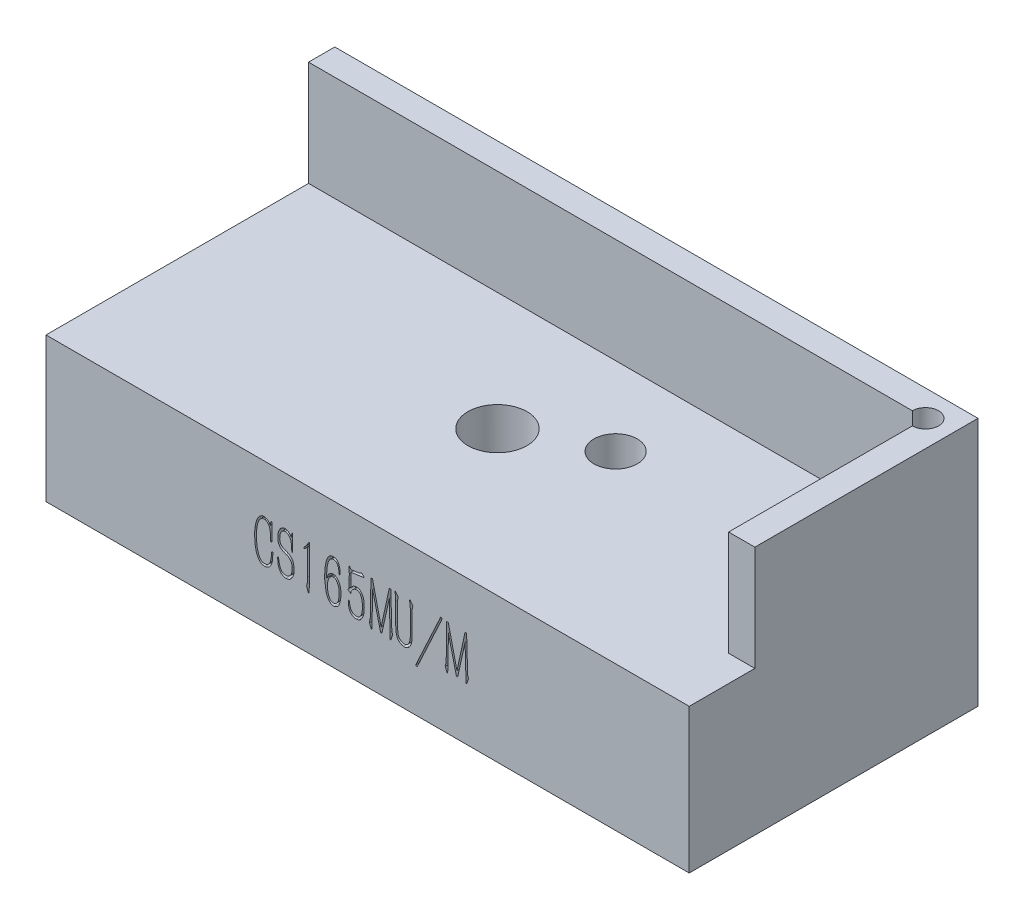
from build123d import *

# Parameters (mm, degrees)
SKETCH_1_W                = 47
SKETCH_1_H                = 18
EXTRUDE_1_DEPTH           = 6
EXTRUDE_2_DEPTH           = 8
EXTRUDE_2_DEPTH_BACK      = 6
SKETCH_15_W               = 49
SKETCH_15_H               = 22
EXTRUDE_3_DEPTH           = 5
SKETCH_12_W               = 2
SKETCH_12_H               = 8
CUT_EXTRUDE_5_DEPTH       = 37
SKETCH_19_W               = 10
SKETCH_19_H               = 8
EXTRUDE_4_DEPTH           = 3
SKETCH_13_R               = 1
CUT_EXTRUDE_6_DEPTH       = 8
CUT_EXTRUDE_START         = -2.844
SKETCH_5_W                = 25
SKETCH_5_H                = 25
CUT_EXTRUDE_1_DEPTH       = 2.844
HOLE_WIZARD_2_D           = 4.5
HOLE_WIZARD_2_CBORE_D     = 8
HOLE_WIZARD_2_CBORE_DEPTH = 4.6
HOLE_WIZARD_M4_4_D        = 3.3
SKETCH_17_W               = 20.485510756
SKETCH_17_H               = 2.844
CUT_EXTRUDE_8_DEPTH       = 1
SKETCH_18_R               = 1
CUT_EXTRUDE_9_DEPTH       = 2.844
FILLET_1_R                = 1
CUT_EXTRUDE_10_DEPTH      = 0.5
SKETCH_22_W               = 5
SKETCH_22_H               = 8
CUT_EXTRUDE_11_DEPTH      = 42.060930486


with BuildPart() as part:
    # 草图1 → 凸台-拉伸1 (new body)
    with BuildSketch(Plane(origin=(0, 0, 0), x_dir=(1, 0, 0), z_dir=(0, 1, 0))):
        Rectangle(SKETCH_1_W, SKETCH_1_H)
    extrude(amount=EXTRUDE_1_DEPTH)

    # 草图2 → 凸台-拉伸2 (add, two sides: drawn at the far end of the back side and taken through both)
    with BuildSketch(Plane(origin=(0, 6, 0), x_dir=(1, 0, 0), z_dir=(0, 1, 0)).offset(-EXTRUDE_2_DEPTH_BACK)):
        Polygon((23.5, 9), (-23.5, 9), (-23.5, 11), (25.5, 11), (25.5, -11), (-23.5, -11), (-23.5, -9), (23.5, -9), align=None)
    extrude(amount=EXTRUDE_2_DEPTH + EXTRUDE_2_DEPTH_BACK)

    # 草图15 → 凸台-拉伸3 (add)
    with BuildSketch(Plane(origin=(0, 0, 10), x_dir=(1, 0, 0), z_dir=(0, 1, 0))):
        with Locations((1, 10)):
            Rectangle(SKETCH_15_W, SKETCH_15_H)
    extrude(amount=-EXTRUDE_3_DEPTH)

    # 草图12 → 切除-拉伸5 (cut)
    with BuildSketch(Plane.ZY.offset(23.5)):
        with Locations((10, 10)):
            Rectangle(SKETCH_12_W, SKETCH_12_H)
    extrude(amount=-CUT_EXTRUDE_5_DEPTH, mode=Mode.SUBTRACT)

    # 草图19 → 凸台-拉伸4 (add)
    with BuildSketch(Plane(origin=(0, 0, 9), x_dir=(-1, 0, 0), z_dir=(0, 0, -1))):
        with Locations((-18.5, 10)):
            Rectangle(SKETCH_19_W, SKETCH_19_H)
    extrude(amount=EXTRUDE_4_DEPTH)

    # 草图13 → 切除-拉伸6 (cut)
    with BuildSketch(Plane(origin=(0, 14, 0), x_dir=(1, 0, 0), z_dir=(0, 1, 0))):
        with Locations((23.5, 9)):
            Circle(SKETCH_13_R)
    extrude(amount=-CUT_EXTRUDE_6_DEPTH, mode=Mode.SUBTRACT)

    # 草图5 → 切除-拉伸1 (cut)
    with BuildSketch(Plane.XZ.offset(5).offset(CUT_EXTRUDE_START)):
        with Locations((5.878, -3.014489244)):
            Rectangle(SKETCH_5_W, SKETCH_5_H)
    extrude(amount=CUT_EXTRUDE_1_DEPTH, mode=Mode.SUBTRACT)

    # 打孔尺寸(%根据)内六角圆柱头螺钉的类型2 (through all)
    with Locations(Plane(origin=(-0.122, -5, -0.014489244), x_dir=(0, 0, -1), z_dir=(0, -1, 0))):
        with Locations((0, 0)):
            CounterBoreHole(HOLE_WIZARD_2_D / 2, HOLE_WIZARD_2_CBORE_D / 2, HOLE_WIZARD_2_CBORE_DEPTH)

    # M4 螺纹孔4 (through all)
    with Locations(Plane(origin=(5.878, -2.156, -3.014489244), x_dir=(0, 0, -1), z_dir=(0, -1, 0))):
        with Locations((0, 0)):
            Hole(HOLE_WIZARD_M4_4_D / 2)

    # 草图17 → 切除-拉伸8 (cut)
    with BuildSketch(Plane.ZY.offset(-18.378)):
        with Locations((-0.757244622, -3.578)):
            Rectangle(SKETCH_17_W, SKETCH_17_H)
    extrude(amount=-CUT_EXTRUDE_8_DEPTH, mode=Mode.SUBTRACT)

    # 草图18 → 切除-拉伸9 (cut)
    with BuildSketch(Plane(origin=(0, -5, 0), x_dir=(-1, 0, 0), z_dir=(0, -1, 0))):
        with Locations((6.622, -9.485510756)):
            Circle(SKETCH_18_R)
    extrude(amount=-CUT_EXTRUDE_9_DEPTH, mode=Mode.SUBTRACT)

    # 圆角1
    fillet_1_edges = [part.edges().sort_by_distance(p)[0] for p in [
        (19.378, -3.578, 9.485510756),
    ]]
    fillet(fillet_1_edges, radius=FILLET_1_R)

    # 草图21 → 切除-拉伸10 (cut)
    # profile 1 of 9: a face of its own
    with BuildSketch(Plane.XY.offset(11)):
        with BuildLine():
            Line((-6.404529551, 1.977324379), (-6.368731553, 2.274149437))
            Line((-6.368731553, 2.274149437), (-6.293406601, 2.274149437))
            Line((-6.293406601, 2.274149437), (-6.293406601, 0.930232966))
            Line((-6.293406601, 0.930232966), (-6.388867927, 0.930232966))
            add(Edge.make_bspline(
                [(-6.388867927, 0.930232966), (-6.388998537, 0.954597823), (-6.389271799, 1.005574193), (-6.392188154, 1.087089471), (-6.394049747, 1.180082111), (-6.39721808, 1.284985426), (-6.400195332, 1.397305637), (-6.411185381, 1.512316757), (-6.427986492, 1.628553305), (-6.453626153, 1.745146106), (-6.487342911, 1.857579559), (-6.527180565, 1.943155896), (-6.56437731, 2.003243187), (-6.594847331, 2.042304377), (-6.628810824, 2.075586288), (-6.677413498, 2.11179761), (-6.743793985, 2.14827976), (-6.802536246, 2.158612708), (-6.83186814, 2.16377228)],
                knots=[0, 0, 0, 0, 0.822473136, 1.720785642, 2.753326599, 3.962261781, 5.264018637, 6.545024146, 7.860049611, 9.226346671, 10.572050264, 11.814683136, 12.399128484, 12.954850798, 13.483022901, 13.998303406, 15.000488703, 16, 16, 16, 16], degree=3))
            add(Edge.make_bspline(
                [(-6.83186814, 2.16377228), (-6.8542937, 2.164370524), (-6.899050502, 2.165564496), (-6.965592365, 2.152108538), (-7.029693388, 2.126994484), (-7.091192646, 2.090603956), (-7.149777714, 2.043837859), (-7.201736986, 1.984010862), (-7.25114426, 1.915329067), (-7.292121218, 1.834905788), (-7.328432894, 1.748472636), (-7.362210466, 1.658544746), (-7.388408251, 1.564818596), (-7.416746085, 1.4374751), (-7.441942575, 1.279498902), (-7.460045467, 1.095605621), (-7.469507735, 0.923883107), (-7.472837785, 0.763673221), (-7.469548615, 0.609704747), (-7.464083527, 0.508102223), (-7.461316254, 0.456655297)],
                knots=[0, 0, 0, 0, 0.603095173, 1.203653813, 1.814626149, 2.451293107, 3.123130818, 3.825388984, 4.580186105, 5.398460658, 6.251023789, 7.107448911, 7.985514538, 8.871470416, 10.622993602, 12.29317529, 13.850163291, 15.257553743, 16.61134915, 18, 18, 18, 18], degree=3))
            add(Edge.make_bspline(
                [(-7.461316254, 0.456655297), (-7.457292554, 0.410646941), (-7.44905919, 0.316503855), (-7.43535596, 0.197077022), (-7.419511734, 0.09598192), (-7.403801904, 0.012674287), (-7.384219555, -0.077547531), (-7.362248008, -0.171216872), (-7.33751905, -0.260831139), (-7.314299952, -0.340298679), (-7.290895289, -0.405198221), (-7.260099474, -0.47218883), (-7.216527729, -0.54249424), (-7.159924702, -0.618270207), (-7.096452416, -0.680964884), (-7.028403586, -0.72868775), (-6.95248104, -0.75642665), (-6.89946389, -0.759591402), (-6.872140887, -0.761222393)],
                knots=[0, 0, 0, 0, 1.515526627, 3.101096572, 3.943353373, 4.87293365, 5.882541642, 6.972773351, 8.029529644, 8.932786276, 9.68898916, 10.291221641, 11.348890653, 12.39638072, 13.388602443, 14.264213047, 15.105442077, 16, 16, 16, 16], degree=3))
            add(Edge.make_bspline(
                [(-6.872140887, -0.761222393), (-6.846678098, -0.761565886), (-6.794825513, -0.762265378), (-6.717594662, -0.74262407), (-6.642624378, -0.711248516), (-6.572597011, -0.664921153), (-6.510810886, -0.603417296), (-6.458263495, -0.526887854), (-6.416593242, -0.43574114), (-6.387799118, -0.331617384), (-6.364568445, -0.219279843), (-6.349467489, -0.1234157), (-6.338781712, -0.050961182), (-6.331867617, -0.007522334), (-6.32753187, 0.024851553), (-6.324987679, 0.042493683), (-6.323984057, 0.049453081)],
                knots=[0, 0, 0, 0, 0.974493461, 1.984464659, 3.032762083, 4.086915356, 5.187622472, 6.361151533, 7.634420725, 9.018373663, 10.501751059, 12.040324543, 12.745324753, 13.31527632, 13.729892907, 14, 14, 14, 14], degree=3))
            Line((-6.323984057, 0.049453081), (-6.298627143, 0.315700684))
            Line((-6.298627143, 0.315700684), (-6.218081649, 0.311225934))
            add(Edge.make_bspline(
                [(-6.218081649, 0.311225934), (-6.217981254, 0.286365245), (-6.217798528, 0.241117274), (-6.218909088, 0.179472492), (-6.219126653, 0.130475892), (-6.221124443, 0.090474084), (-6.222421138, 0.052898184), (-6.225686216, 0.010889992), (-6.230110014, -0.03908595), (-6.238077883, -0.112845331), (-6.246099595, -0.201247667), (-6.257325139, -0.300210907), (-6.274037055, -0.396906194), (-6.305395955, -0.497833888), (-6.348566338, -0.603785388), (-6.397327769, -0.688326032), (-6.443809006, -0.750874428), (-6.484488821, -0.792546759), (-6.529628714, -0.830565643), (-6.579937885, -0.862693391), (-6.633027921, -0.889705811), (-6.68834108, -0.908870017), (-6.744421596, -0.923264829), (-6.782807944, -0.926109144), (-6.802036476, -0.927533921)],
                knots=[0, 0, 0, 0, 1.082557886, 1.97032136, 2.684891572, 3.215786613, 3.714233695, 4.322010655, 5.050226996, 5.899051791, 7.552532718, 8.915438272, 10.236158893, 11.818471953, 13.507262255, 15.209909354, 16.052150521, 16.894322113, 17.739826851, 18.616631911, 19.488074199, 20.326969254, 21.161943562, 22, 22, 22, 22], degree=3))
            add(Edge.make_bspline(
                [(-6.802036476, -0.927533921), (-6.834201317, -0.928942879), (-6.899716237, -0.931812715), (-6.996360967, -0.909776383), (-7.086758987, -0.874861179), (-7.155590972, -0.834705602), (-7.204691376, -0.794873617), (-7.239702365, -0.758231837), (-7.275085151, -0.71649215), (-7.30896386, -0.667757036), (-7.342847152, -0.613261914), (-7.374413082, -0.552179067), (-7.40499261, -0.485374364), (-7.44593026, -0.386764692), (-7.490068441, -0.250221895), (-7.525277358, -0.104504447), (-7.548957024, 0.021511655), (-7.563210025, 0.12440379), (-7.576934467, 0.233246173), (-7.591462692, 0.384832327), (-7.603435293, 0.573302146), (-7.609555717, 0.795977506), (-7.603106129, 1.016614859), (-7.585746452, 1.163012741), (-7.576913953, 1.237499107)],
                knots=[0, 0, 0, 0, 0.828879423, 1.68830212, 2.536676829, 3.328986324, 3.73541648, 4.167069034, 4.63682846, 5.148487351, 5.699502401, 6.294435402, 6.924061178, 7.598240742, 9.053084533, 10.627089957, 11.470192478, 12.366164513, 13.311378798, 14.305576584, 16.301598498, 18.191207909, 20.062109376, 22, 22, 22, 22], degree=3))
            add(Edge.make_bspline(
                [(-7.576913953, 1.237499107), (-7.56683564, 1.31206938), (-7.546778343, 1.460474999), (-7.502022914, 1.640517173), (-7.459421403, 1.776000751), (-7.426319504, 1.86634465), (-7.391170164, 1.944946754), (-7.355135028, 2.013468875), (-7.316445257, 2.073147809), (-7.27576758, 2.126749789), (-7.230345134, 2.172799006), (-7.184118953, 2.213661026), (-7.137700258, 2.247005494), (-7.095037663, 2.274670804), (-7.057462385, 2.297020705), (-7.010807162, 2.316526478), (-6.94937325, 2.33154451), (-6.898837258, 2.330100719), (-6.872140887, 2.329338016)],
                knots=[0, 0, 0, 0, 2.546659555, 5.068220541, 6.268960188, 7.35572531, 8.324149365, 9.182807276, 9.974388089, 10.730435642, 11.456747585, 12.160764052, 12.817438768, 13.389505863, 13.883390408, 14.294592413, 15.099093679, 16, 16, 16, 16], degree=3))
            add(Edge.make_bspline(
                [(-6.872140887, 2.329338016), (-6.844842057, 2.324663393), (-6.788891457, 2.31508247), (-6.707072544, 2.285066228), (-6.626270064, 2.243622889), (-6.556329952, 2.185115249), (-6.494467446, 2.124666362), (-6.463577806, 2.079008001), (-6.449277047, 2.057869872)],
                knots=[0, 0, 0, 0, 0.959137923, 1.965811105, 3.01152559, 4.09188384, 5.116612916, 6, 6, 6, 6], degree=3))
            Line((-6.449277047, 2.057869872), (-6.404529551, 1.977324379))
        make_face()
    # profile 2 of 9: a face of its own
    with BuildSketch(Plane.XY.offset(11)):
        with BuildLine():
            Line((-4.812264475, 1.992240211), (-4.761550646, 2.299506352))
            Line((-4.761550646, 2.299506352), (-4.711582608, 2.294285811))
            Line((-4.711582608, 2.294285811), (-4.711582608, 1.036135374))
            Line((-4.711582608, 1.036135374), (-4.771991728, 1.030914833))
            Line((-4.771991728, 1.030914833), (-4.807043934, 1.56415583))
            add(Edge.make_bspline(
                [(-4.807043934, 1.56415583), (-4.811659053, 1.593808023), (-4.820190245, 1.648621033), (-4.836913193, 1.722850162), (-4.85242376, 1.783594458), (-4.876458144, 1.845153365), (-4.912123839, 1.910875501), (-4.964659242, 1.981319291), (-5.027692298, 2.04477476), (-5.102442113, 2.094691123), (-5.183460171, 2.132841426), (-5.241708783, 2.140091899), (-5.27018052, 2.143635906)],
                knots=[0, 0, 0, 0, 1.116474761, 2.063838624, 2.831507158, 3.446633667, 4.518832044, 5.603216916, 6.708904972, 7.82779241, 8.938231816, 10, 10, 10, 10], degree=3))
            add(Edge.make_bspline(
                [(-5.27018052, 2.143635906), (-5.287143795, 2.142908796), (-5.321971386, 2.141415954), (-5.365689537, 2.131133984), (-5.402947961, 2.117497548), (-5.433760836, 2.099953865), (-5.467652389, 2.076457355), (-5.503056592, 2.04728862), (-5.538656016, 2.013958689), (-5.57022934, 1.975224257), (-5.597946515, 1.932808378), (-5.627668151, 1.871668282), (-5.657264351, 1.793741541), (-5.676829488, 1.713030163), (-5.685381435, 1.645560017), (-5.690634457, 1.58859649), (-5.694007693, 1.524662309), (-5.696967115, 1.455531438), (-5.694423727, 1.384309782), (-5.684161271, 1.314661411), (-5.6656849, 1.248395674), (-5.647084191, 1.207215892), (-5.637855781, 1.186785278)],
                knots=[0, 0, 0, 0, 0.864038106, 1.773971445, 2.275285977, 2.88209936, 3.574564674, 4.376127188, 5.218616224, 6.055847121, 6.916999662, 7.795414815, 9.515900782, 11.157236165, 12.013901558, 12.981067707, 14.072720019, 15.277182195, 16.507433409, 17.699229733, 18.858513907, 20, 20, 20, 20], degree=3))
            add(Edge.make_bspline(
                [(-5.637855781, 1.186785278), (-5.627407317, 1.167839649), (-5.607031215, 1.130892775), (-5.568923094, 1.081703529), (-5.524168749, 1.041836848), (-5.461306162, 1.00121952), (-5.385901121, 0.964918283), (-5.326464606, 0.94091549), (-5.300012184, 0.930232966)],
                knots=[0, 0, 0, 0, 0.892298636, 1.740118821, 2.553971753, 3.353728668, 4.822268012, 6, 6, 6, 6], degree=3))
            Line((-5.300012184, 0.930232966), (-5.124005366, 0.859382763))
            add(Edge.make_bspline(
                [(-5.124005366, 0.859382763), (-5.102290556, 0.84936827), (-5.060480071, 0.830086001), (-5.001552047, 0.799410625), (-4.948200714, 0.769076748), (-4.886814905, 0.727991249), (-4.819175072, 0.674030125), (-4.75233946, 0.599610053), (-4.698029205, 0.515271016), (-4.663962441, 0.416932893), (-4.637131047, 0.310252486), (-4.619014211, 0.19435947), (-4.607052858, 0.067833808), (-4.602245115, -0.06753276), (-4.604374348, -0.207417473), (-4.622255774, -0.298734476), (-4.631037115, -0.343579095)],
                knots=[0, 0, 0, 0, 0.703245545, 1.354054533, 1.953549274, 2.507188807, 3.525842386, 4.488918984, 5.43838142, 6.454223102, 7.53246407, 8.673253088, 9.899948524, 11.268249991, 12.658472344, 14, 14, 14, 14], degree=3))
            add(Edge.make_bspline(
                [(-4.631037115, -0.343579095), (-4.642016531, -0.388552482), (-4.663282995, -0.475663206), (-4.70929354, -0.575746847), (-4.74962474, -0.646519629), (-4.779503019, -0.692385433), (-4.809379423, -0.731800881), (-4.848425784, -0.778057455), (-4.908646251, -0.826818368), (-4.978905285, -0.865647044), (-5.043578436, -0.889787604), (-5.097259481, -0.903588915), (-5.154895953, -0.91058435), (-5.194591275, -0.9119277), (-5.214991941, -0.912618089)],
                knots=[0, 0, 0, 0, 1.868422262, 3.619020558, 4.429541533, 5.162879566, 5.830420081, 6.429075538, 7.606854402, 8.938752151, 9.657684361, 10.394048182, 11.174651193, 12, 12, 12, 12], degree=3))
            add(Edge.make_bspline(
                [(-5.214991941, -0.912618089), (-5.237900894, -0.912472355), (-5.282740791, -0.912187107), (-5.348344557, -0.901576263), (-5.410252593, -0.882155686), (-5.467902585, -0.853279814), (-5.521820103, -0.817213792), (-5.571895475, -0.774431345), (-5.618207458, -0.725383934), (-5.661939538, -0.671020337), (-5.700245345, -0.609634232), (-5.734858479, -0.54287093), (-5.764464145, -0.470387074), (-5.797656679, -0.368088064), (-5.826824014, -0.238132079), (-5.835166683, -0.132918516), (-5.839219514, -0.081806241)],
                knots=[0, 0, 0, 0, 0.833862414, 1.63212638, 2.411403016, 3.189256699, 3.973153178, 4.770028097, 5.583768076, 6.428386665, 7.307987397, 8.215552436, 9.166047206, 10.157242313, 12.13320567, 14, 14, 14, 14], degree=3))
            Line((-5.839219514, -0.081806241), (-5.859355888, 0.185187153))
            Line((-5.859355888, 0.185187153), (-5.788505685, 0.185187153))
            add(Edge.make_bspline(
                [(-5.788505685, 0.185187153), (-5.784430162, 0.153593959), (-5.776589431, 0.092813125), (-5.762812673, 0.005135895), (-5.749533617, -0.075685559), (-5.732559204, -0.172274513), (-5.706004438, -0.281382373), (-5.664170175, -0.399956268), (-5.609540987, -0.504014473), (-5.551175917, -0.577112251), (-5.50098385, -0.627967418), (-5.460970014, -0.657164406), (-5.421991543, -0.682386499), (-5.369164462, -0.703959035), (-5.303341895, -0.721195688), (-5.250401169, -0.721030083), (-5.224687232, -0.720949647)],
                knots=[0, 0, 0, 0, 1.134650933, 2.182907786, 3.161205505, 4.052250561, 5.675932663, 7.155002512, 8.52184542, 9.839854562, 10.472309825, 11.060302883, 11.600982628, 12.120735338, 13.087218943, 14, 14, 14, 14], degree=3))
            add(Edge.make_bspline(
                [(-5.224687232, -0.720949647), (-5.201990309, -0.720138369), (-5.158451569, -0.718582123), (-5.096188763, -0.70536692), (-5.039471052, -0.685114782), (-4.989496448, -0.654030234), (-4.944678658, -0.616509706), (-4.904238629, -0.572625762), (-4.86717533, -0.523197846), (-4.836268085, -0.467707413), (-4.80898212, -0.410347758), (-4.786555969, -0.3533374), (-4.769920668, -0.297673654), (-4.758642474, -0.242725669), (-4.750992999, -0.185903509), (-4.747094785, -0.125368534), (-4.744251878, -0.059691505), (-4.745817657, -0.014437207), (-4.746634814, 0.009180334)],
                knots=[0, 0, 0, 0, 1.108065456, 2.12556444, 3.098260599, 4.035950869, 4.98490885, 5.94776606, 6.946521194, 7.996930623, 9.045863326, 10.049925535, 10.987930625, 11.881525266, 12.788809675, 13.787786499, 14.845478855, 16, 16, 16, 16], degree=3))
            add(Edge.make_bspline(
                [(-4.746634814, 0.009180334), (-4.74924579, 0.046041999), (-4.75411898, 0.114841503), (-4.769921597, 0.209532985), (-4.789211948, 0.289069782), (-4.814953332, 0.354445934), (-4.846226683, 0.408496236), (-4.879094004, 0.457078595), (-4.916139176, 0.500398882), (-4.958348223, 0.538136089), (-5.00472024, 0.573119022), (-5.056932831, 0.605650592), (-5.115413228, 0.636553132), (-5.157412313, 0.654125936), (-5.179193944, 0.663239571)],
                knots=[0, 0, 0, 0, 1.578487453, 2.946127177, 4.097996722, 5.070650713, 5.936469873, 6.761635482, 7.575228913, 8.364955199, 9.176673428, 10.055112166, 10.991339211, 12, 12, 12, 12], degree=3))
            Line((-5.179193944, 0.663239571), (-5.396219301, 0.743785065))
            add(Edge.make_bspline(
                [(-5.396219301, 0.743785065), (-5.429990278, 0.7585476), (-5.49691039, 0.78780084), (-5.58825067, 0.846965166), (-5.667841431, 0.918586645), (-5.731933746, 1.005524781), (-5.781151374, 1.106747964), (-5.811220434, 1.201581001), (-5.827968572, 1.286781306), (-5.835420128, 1.359404456), (-5.84031536, 1.439294354), (-5.839596426, 1.494789128), (-5.839219514, 1.523883083)],
                knots=[0, 0, 0, 0, 1.141640751, 2.262259852, 3.359181592, 4.444772656, 5.58953336, 6.835542724, 7.519006772, 8.279340868, 9.097919025, 10, 10, 10, 10], degree=3))
            add(Edge.make_bspline(
                [(-5.839219514, 1.523883083), (-5.839006972, 1.549000527), (-5.83859611, 1.597554736), (-5.833374246, 1.667796992), (-5.824501475, 1.732534708), (-5.808603458, 1.811568248), (-5.780154794, 1.90438267), (-5.735962423, 2.008286924), (-5.684751695, 2.101095776), (-5.625878758, 2.178922753), (-5.558664367, 2.239772552), (-5.497470099, 2.281897479), (-5.441880158, 2.306916501), (-5.394212721, 2.320444061), (-5.341230927, 2.327332035), (-5.304255401, 2.328653363), (-5.285096352, 2.329338016)],
                knots=[0, 0, 0, 0, 0.971164436, 1.877345498, 2.721647718, 3.496542433, 4.992871533, 6.466013358, 7.856401207, 9.083219229, 10.219456221, 11.349985082, 11.939558551, 12.569451447, 13.258754286, 14, 14, 14, 14], degree=3))
            add(Edge.make_bspline(
                [(-5.285096352, 2.329338016), (-5.263622162, 2.326895167), (-5.220912924, 2.322036673), (-5.158268684, 2.305058488), (-5.097667603, 2.28068072), (-5.041071639, 2.247587489), (-4.989020924, 2.210738995), (-4.942186494, 2.17249193), (-4.903907789, 2.131109296), (-4.882842552, 2.101833857), (-4.872673595, 2.087701536)],
                knots=[0, 0, 0, 0, 1.049956055, 2.088219507, 3.145806661, 4.218152357, 5.268178035, 6.24663062, 7.15358473, 8, 8, 8, 8], degree=3))
            Line((-4.872673595, 2.087701536), (-4.812264475, 1.992240211))
        make_face()
    # profile 3 of 9: a face of its own
    with BuildSketch(Plane.XY.offset(11)):
        with BuildLine():
            Line((-3.481026461, 2.324863266), (-3.425837882, 2.324863266))
            Line((-3.425837882, 2.324863266), (-3.431058423, -0.348799636))
            add(Edge.make_bspline(
                [(-3.431058423, -0.348799636), (-3.431653141, -0.372911925), (-3.432793445, -0.419144555), (-3.432885991, -0.485291459), (-3.435061403, -0.545181346), (-3.435234674, -0.59889996), (-3.436852276, -0.646377124), (-3.438722875, -0.687622773), (-3.438900618, -0.722714222), (-3.442209375, -0.777636868), (-3.446152197, -0.853151411), (-3.455930193, -0.930930107), (-3.463714212, -0.986350682), (-3.47162731, -1.011579096), (-3.481652393, -1.031540645), (-3.491657406, -1.02921276), (-3.495942293, -1.028215788)],
                knots=[0, 0, 0, 0, 1.45038606, 2.780953852, 3.977268029, 5.053718292, 6.010937745, 6.833690271, 7.536464333, 8.120251454, 10.142880859, 12.069479857, 12.873132744, 13.440417135, 13.76034519, 14, 14, 14, 14], degree=3))
            add(Edge.make_bspline(
                [(-3.495942293, -1.028215788), (-3.496932822, -1.027466025), (-3.501172529, -1.024256857), (-3.511283056, -1.01746423), (-3.523296448, -0.999256191), (-3.528555159, -0.982921133), (-3.53174029, -0.973027209)],
                knots=[0, 0, 0, 0, 0.221265066, 0.947068446, 2.150880552, 4, 4, 4, 4], degree=3))
            Line((-3.53174029, -0.973027209), (-3.556351413, -0.907397548))
            Line((-3.556351413, -0.907397548), (-3.612285783, -0.726170188))
            add(Edge.make_bspline(
                [(-3.612285783, -0.726170188), (-3.619019075, -0.709118561), (-3.630748122, -0.679415506), (-3.642580141, -0.640337012), (-3.65155631, -0.615383743), (-3.653942103, -0.595158033), (-3.642449726, -0.576186264), (-3.633985984, -0.546975524), (-3.620962547, -0.509689936), (-3.608663961, -0.465682839), (-3.597801409, -0.418133866), (-3.588016145, -0.366758695), (-3.582470554, -0.308875962), (-3.579750226, -0.253610103), (-3.577662536, -0.200400669), (-3.577283235, -0.149174805), (-3.576237072, -0.088521816), (-3.576400502, -0.044765932), (-3.576487786, -0.021397121)],
                knots=[0, 0, 0, 0, 1.220359697, 2.125803599, 2.712350858, 2.994193817, 3.439826662, 4.12562012, 5.031064022, 6.063176816, 7.167225426, 8.277459231, 9.542238136, 11.034069985, 11.961482632, 13.08703073, 14.444263491, 16, 16, 16, 16], degree=3))
            Line((-3.576487786, -0.021397121), (-3.572013037, 1.951967464))
            Line((-3.572013037, 1.951967464), (-3.83378589, 1.725246816))
            Line((-3.83378589, 1.725246816), (-3.853922263, 1.811012851))
            add(Edge.make_bspline(
                [(-3.853922263, 1.811012851), (-3.832643824, 1.83299997), (-3.792756513, 1.874215732), (-3.739449385, 1.933559021), (-3.695606136, 1.985059596), (-3.649940468, 2.045266181), (-3.598812542, 2.120192902), (-3.561056183, 2.181750882), (-3.541435581, 2.213740317)],
                knots=[0, 0, 0, 0, 1.077185482, 2.019228619, 2.808185376, 3.45765616, 4.678836699, 6, 6, 6, 6], degree=3))
            Line((-3.541435581, 2.213740317), (-3.481026461, 2.324863266))
        make_face()
    # profile 4 of 9: a face of its own
    with BuildSketch(Plane.XY.offset(11)):
        with BuildLine():
            Line((-1.093747535, 1.368012638), (-1.163851946, 1.368012638))
            add(Edge.make_bspline(
                [(-1.163851946, 1.368012638), (-1.168643523, 1.39805268), (-1.178123918, 1.457488521), (-1.186855684, 1.548312184), (-1.1975045, 1.642686511), (-1.215737176, 1.742542994), (-1.2444241, 1.846359636), (-1.284774604, 1.92889252), (-1.322946218, 1.990734389), (-1.355487993, 2.032089736), (-1.392821512, 2.066731107), (-1.432724749, 2.095894259), (-1.475695289, 2.118441359), (-1.520745947, 2.134710931), (-1.56855724, 2.141989786), (-1.617220761, 2.141531276), (-1.664602409, 2.136012986), (-1.708613689, 2.124537472), (-1.748297993, 2.109002909), (-1.78513503, 2.08843288), (-1.818936356, 2.058687114), (-1.854193296, 2.021410607), (-1.889561551, 1.972820112), (-1.926581997, 1.915427779), (-1.962461529, 1.848392484), (-1.994116836, 1.772084154), (-2.022384623, 1.68756909), (-2.055213059, 1.56267114), (-2.085653701, 1.394967931), (-2.103909982, 1.22338885), (-2.112541877, 1.088632709), (-2.11682584, 0.998367061), (-2.120338438, 0.920067661), (-2.120588086, 0.871815735), (-2.120702574, 0.849687473)],
                knots=[0, 0, 0, 0, 1.172618578, 2.320089015, 3.517365984, 4.833421129, 6.231766425, 7.655217032, 8.357323983, 9.032478261, 9.676711985, 10.315215253, 10.932648665, 11.54199308, 12.153444918, 12.786093219, 13.413857257, 13.988112725, 14.53457488, 15.054145165, 15.605211832, 16.262994999, 17.029841423, 17.917944275, 18.895673466, 19.956732694, 21.09950916, 22.329492637, 24.933332206, 27.662278065, 28.97833321, 30.139613505, 31.146829503, 32, 32, 32, 32], degree=3))
            Line((-2.120702574, 0.849687473), (-2.125177324, 0.653544281))
            add(Edge.make_bspline(
                [(-2.125177324, 0.653544281), (-2.112727905, 0.688672729), (-2.090225418, 0.752167856), (-2.055675251, 0.83977108), (-2.016553481, 0.914054628), (-1.970947405, 0.982744201), (-1.911929791, 1.0461413), (-1.851640074, 1.092459806), (-1.794949462, 1.124475472), (-1.744606287, 1.142823738), (-1.687923348, 1.155498308), (-1.647934902, 1.159389904), (-1.626988532, 1.161428363)],
                knots=[0, 0, 0, 0, 1.463710204, 2.645675197, 3.693667506, 4.755032446, 5.874045908, 7.078730407, 7.725382873, 8.423483439, 9.174203962, 10, 10, 10, 10], degree=3))
            add(Edge.make_bspline(
                [(-1.626988532, 1.161428363), (-1.596727283, 1.160271209), (-1.539178737, 1.158070621), (-1.456329732, 1.133301853), (-1.378878481, 1.089838471), (-1.319218026, 1.036694546), (-1.271056211, 0.984247743), (-1.235582103, 0.936221611), (-1.20096566, 0.881897267), (-1.156470296, 0.800495375), (-1.108489618, 0.689481285), (-1.073820839, 0.570855611), (-1.055812295, 0.470346506), (-1.044069641, 0.389331014), (-1.037851231, 0.302867734), (-1.034227796, 0.181989732), (-1.036003683, 0.031118562), (-1.044230876, -0.088794447), (-1.048254247, -0.147435903)],
                knots=[0, 0, 0, 0, 0.909148716, 1.728949998, 2.576991438, 3.564625719, 4.121218537, 4.72026629, 5.360049571, 6.060456872, 7.512703724, 8.993852322, 9.770776208, 10.587253518, 11.458483217, 12.380006039, 14.229702395, 16, 16, 16, 16], degree=3))
            add(Edge.make_bspline(
                [(-1.048254247, -0.147435903), (-1.052954294, -0.177813344), (-1.062702087, -0.240815485), (-1.083356851, -0.338002197), (-1.108693918, -0.441233254), (-1.137802441, -0.546723474), (-1.171506282, -0.646886415), (-1.216096092, -0.732244249), (-1.270023084, -0.799255947), (-1.33233258, -0.845454876), (-1.393869252, -0.875898001), (-1.448904947, -0.899465534), (-1.496809535, -0.916473683), (-1.527453874, -0.920502994), (-1.541222497, -0.92231338)],
                knots=[0, 0, 0, 0, 1.110217054, 2.302565578, 3.587623031, 4.949459538, 6.256081064, 7.397105523, 8.411240029, 9.334418742, 10.173869837, 10.886090718, 11.499516107, 12, 12, 12, 12], degree=3))
            add(Edge.make_bspline(
                [(-1.541222497, -0.92231338), (-1.566348614, -0.924419782), (-1.616444196, -0.928619453), (-1.679714499, -0.917126257), (-1.730452644, -0.899413461), (-1.771569532, -0.878245321), (-1.817263678, -0.852601956), (-1.864874091, -0.819115984), (-1.913247558, -0.780166578), (-1.956533313, -0.732046173), (-1.99642102, -0.678326267), (-2.042410095, -0.597038301), (-2.09077807, -0.489180817), (-2.135652222, -0.377195068), (-2.164538835, -0.278105806), (-2.184124752, -0.189355104), (-2.202646306, -0.086339053), (-2.218646828, 0.025952212), (-2.23276346, 0.136904708), (-2.244563498, 0.236390962), (-2.254543897, 0.319114769), (-2.263624325, 0.407038887), (-2.269958935, 0.50477755), (-2.272006598, 0.619982323), (-2.270045952, 0.741321076), (-2.267487209, 0.825328305), (-2.266131937, 0.869823846)],
                knots=[0, 0, 0, 0, 0.848219995, 1.691151707, 2.144998995, 2.659153853, 3.249319417, 3.912736756, 4.621867519, 5.340468245, 6.090710837, 6.87657341, 8.487178015, 10.078339935, 10.944022033, 11.968008362, 13.14490399, 14.476453821, 15.796264219, 16.920399402, 17.85823784, 18.608902694, 19.903936842, 21.162934464, 22.497310667, 24, 24, 24, 24], degree=3))
            add(Edge.make_bspline(
                [(-2.266131937, 0.869823846), (-2.265234552, 0.905376698), (-2.26354615, 0.972268236), (-2.259724992, 1.066238385), (-2.255777851, 1.147351935), (-2.247332165, 1.240403741), (-2.233417605, 1.354418797), (-2.211476647, 1.493941416), (-2.185734382, 1.633906406), (-2.157671263, 1.746453552), (-2.130667149, 1.832592603), (-2.105285176, 1.898483665), (-2.073383655, 1.9659551), (-2.03872681, 2.035400942), (-1.999149809, 2.101374155), (-1.955568047, 2.160696716), (-1.908527106, 2.210782723), (-1.858172461, 2.253182348), (-1.801333732, 2.285214818), (-1.737902859, 2.307850604), (-1.666954833, 2.319577871), (-1.617580567, 2.319620555), (-1.591936327, 2.319642725)],
                knots=[0, 0, 0, 0, 1.211628523, 2.279639787, 3.204225299, 3.977932759, 5.462339825, 7.116605252, 8.789327199, 10.30942825, 11.064792467, 11.863814246, 12.712679163, 13.606614715, 14.50718602, 15.330439464, 16.109367713, 16.843542067, 17.564206182, 18.319665359, 19.127259812, 20, 20, 20, 20], degree=3))
            add(Edge.make_bspline(
                [(-1.591936327, 2.319642725), (-1.56594513, 2.317491085), (-1.516828984, 2.313425083), (-1.449129094, 2.294990608), (-1.39097497, 2.270512469), (-1.344936925, 2.235813965), (-1.308807596, 2.197550675), (-1.275422026, 2.162795074), (-1.249161475, 2.127576866), (-1.226321076, 2.093030724), (-1.207432123, 2.05467479), (-1.188511832, 2.011300089), (-1.171010928, 1.960255172), (-1.153998248, 1.904431495), (-1.138117557, 1.848222925), (-1.124592144, 1.796025885), (-1.114121303, 1.750014971), (-1.10352302, 1.694512703), (-1.094738494, 1.621607337), (-1.094096763, 1.561703275), (-1.093747535, 1.529103624)],
                knots=[0, 0, 0, 0, 1.358046768, 2.566331314, 3.646368544, 4.629682629, 5.546946845, 6.391627168, 7.141431054, 7.835891544, 8.549473584, 9.368770778, 10.304200405, 11.362836174, 12.414134618, 13.351720444, 14.176238426, 14.875889185, 16.299866179, 18, 18, 18, 18], degree=3))
            Line((-1.093747535, 1.529103624), (-1.093747535, 1.368012638))
        make_face()
        with BuildLine():
            add(Edge.make_bspline(
                [(-2.060293454, 0.124778033), (-2.058785557, 0.079979911), (-2.055690863, -0.011960351), (-2.03688638, -0.151401355), (-2.004191384, -0.292870672), (-1.96512074, -0.408794907), (-1.926362775, -0.497398396), (-1.891544547, -0.557236456), (-1.853795456, -0.611759975), (-1.810623174, -0.658579542), (-1.763146891, -0.698339184), (-1.708283806, -0.723378439), (-1.648886388, -0.738132754), (-1.60793268, -0.736639229), (-1.586715785, -0.735865479)],
                knots=[0, 0, 0, 0, 1.4886747, 3.055242853, 4.666194597, 6.306608966, 7.112592917, 7.87485258, 8.603662743, 9.310999056, 9.986965693, 10.644668568, 11.297843225, 12, 12, 12, 12], degree=3))
            add(Edge.make_bspline(
                [(-1.586715785, -0.735865479), (-1.568418184, -0.734131072), (-1.53174395, -0.730654767), (-1.478486663, -0.711509356), (-1.427282551, -0.682867586), (-1.379228397, -0.643746921), (-1.335573585, -0.597534562), (-1.296719501, -0.546316253), (-1.265319485, -0.49000317), (-1.23250167, -0.407194723), (-1.202227482, -0.293681489), (-1.185575493, -0.147297842), (-1.175324085, 0.005842989), (-1.167418943, 0.163653057), (-1.16920928, 0.327218813), (-1.188837599, 0.436438854), (-1.198904151, 0.492453294)],
                knots=[0, 0, 0, 0, 0.542441635, 1.087226227, 1.660703064, 2.273516638, 2.914006631, 3.539772715, 4.172601069, 4.816509057, 6.173746714, 7.636628278, 9.17189136, 10.71932084, 12.317475397, 14, 14, 14, 14], degree=3))
            add(Edge.make_bspline(
                [(-1.198904151, 0.492453294), (-1.21256928, 0.538393361), (-1.239721712, 0.629675676), (-1.291545892, 0.735865586), (-1.339629725, 0.811704442), (-1.375172294, 0.861166801), (-1.414869807, 0.899286054), (-1.454358555, 0.930024576), (-1.495627057, 0.951489915), (-1.536559435, 0.968160353), (-1.579246969, 0.975365365), (-1.607581945, 0.975605853), (-1.621767991, 0.975726254)],
                knots=[0, 0, 0, 0, 2.076888393, 4.126750173, 5.096135134, 5.973977047, 6.759453719, 7.47553224, 8.136547057, 8.771446398, 9.384918551, 10, 10, 10, 10], degree=3))
            add(Edge.make_bspline(
                [(-1.621767991, 0.975726254), (-1.639051951, 0.97305227), (-1.67385492, 0.96766794), (-1.72399741, 0.949295789), (-1.772059474, 0.92260728), (-1.830290149, 0.876390834), (-1.894039098, 0.811726491), (-1.943322738, 0.73711059), (-1.972342428, 0.671423783), (-1.993131705, 0.615233146), (-2.011527673, 0.550317517), (-2.028617073, 0.477978898), (-2.042638502, 0.398317988), (-2.053135251, 0.312456516), (-2.058887332, 0.220566689), (-2.05981529, 0.157351802), (-2.060293454, 0.124778033)],
                knots=[0, 0, 0, 0, 0.703513377, 1.416593983, 2.138698186, 2.910269809, 4.405335412, 5.780974721, 6.484987373, 7.296510348, 8.193863016, 9.202460595, 10.29132512, 11.452082192, 12.687092747, 14, 14, 14, 14], degree=3))
        make_face(mode=Mode.SUBTRACT)
    # profile 5 of 9: a face of its own
    with BuildSketch(Plane.XY.offset(11)):
        with BuildLine():
            add(Edge.make_bspline(
                [(-0.256223563, 2.143635906), (-0.24449703, 2.144872483), (-0.224179274, 2.147015014), (-0.204243955, 2.151454143), (-0.195814443, 2.153331197)],
                knots=[0, 0, 0, 0, 1.154313806, 2, 2, 2, 2], degree=3))
            Line((-0.195814443, 2.153331197), (-0.089912035, 2.158551739))
            Line((-0.089912035, 2.158551739), (0.106231157, 2.188383403))
            Line((0.106231157, 2.188383403), (0.272542685, 2.208519776))
            add(Edge.make_bspline(
                [(0.272542685, 2.208519776), (0.288079325, 2.211031572), (0.320731962, 2.216310498), (0.351746617, 2.227835478), (0.36800401, 2.233876691)],
                knots=[0, 0, 0, 0, 0.951631555, 2, 2, 2, 2], degree=3))
            Line((0.36800401, 2.233876691), (0.443328962, 2.264454146))
            add(Edge.make_bspline(
                [(0.443328962, 2.264454146), (0.451079572, 2.267330408), (0.464677813, 2.272376734), (0.482027082, 2.280312241), (0.494519996, 2.285385948), (0.501251401, 2.288072731), (0.503738082, 2.289065269)],
                knots=[0, 0, 0, 0, 1.520021181, 2.666837392, 3.507509911, 4, 4, 4, 4], degree=3))
            Line((0.503738082, 2.289065269), (0.54923137, 2.319642725))
            Line((0.54923137, 2.319642725), (0.695406525, 2.173467571))
            add(Edge.make_bspline(
                [(0.695406525, 2.173467571), (0.700884481, 2.166149686), (0.710474702, 2.153338316), (0.714025743, 2.131397028), (0.709343027, 2.115453483), (0.704001506, 2.10142168), (0.688910917, 2.092968345), (0.677113715, 2.092939406), (0.67004961, 2.092922077)],
                knots=[0, 0, 0, 0, 1.452844315, 2.54348448, 3.406058373, 4.120848162, 4.874773518, 6, 6, 6, 6], degree=3))
            Line((0.67004961, 2.092922077), (-0.266664645, 1.962408547))
            Line((-0.266664645, 1.962408547), (-0.281580477, 0.939928257))
            add(Edge.make_bspline(
                [(-0.281580477, 0.939928257), (-0.262518635, 0.963105724), (-0.227356544, 1.00585963), (-0.175097537, 1.067098193), (-0.114365858, 1.119121008), (-0.05202078, 1.152711467), (0.00643613, 1.176538792), (0.058229916, 1.188668061), (0.115445662, 1.196297274), (0.155425422, 1.196907304), (0.176335568, 1.19722636)],
                knots=[0, 0, 0, 0, 1.30943776, 2.415431215, 3.508265892, 4.775479805, 5.486396256, 6.257089544, 7.088425914, 8, 8, 8, 8], degree=3))
            add(Edge.make_bspline(
                [(0.176335568, 1.19722636), (0.197014544, 1.19588639), (0.236101843, 1.193353584), (0.290600827, 1.183721164), (0.337922936, 1.17015765), (0.391926656, 1.142360548), (0.455024626, 1.094230805), (0.514506449, 1.035399476), (0.560803897, 0.978392995), (0.594937605, 0.929409928), (0.623316344, 0.873377058), (0.65039066, 0.813058907), (0.674510232, 0.746886257), (0.694424028, 0.674280519), (0.710705347, 0.595288601), (0.727433399, 0.478969931), (0.74222157, 0.321527334), (0.744294273, 0.192188956), (0.745374562, 0.124778033)],
                knots=[0, 0, 0, 0, 0.737858689, 1.39469691, 1.969129469, 2.484137971, 3.548991738, 4.782985237, 5.456749125, 6.164369648, 6.905359031, 7.690566505, 8.520047268, 9.411980184, 10.370982938, 11.392008999, 13.598323608, 16, 16, 16, 16], degree=3))
            add(Edge.make_bspline(
                [(0.745374562, 0.124778033), (0.744168433, 0.094697003), (0.741835295, 0.036508186), (0.737852695, -0.047844869), (0.730958085, -0.126158861), (0.720344867, -0.220332369), (0.703900995, -0.328210812), (0.675024676, -0.447856763), (0.635253672, -0.558104632), (0.582127828, -0.657381529), (0.522016975, -0.744095575), (0.457682241, -0.813394877), (0.391279303, -0.863792304), (0.320533332, -0.895539062), (0.243297088, -0.90972092), (0.189806994, -0.911613627), (0.161419736, -0.912618089)],
                knots=[0, 0, 0, 0, 0.953497838, 1.844448518, 2.674189816, 3.442807412, 4.845957472, 6.127295929, 7.335424679, 8.547012004, 9.682888764, 10.668703604, 11.530079681, 12.305522429, 13.100738679, 14, 14, 14, 14], degree=3))
            add(Edge.make_bspline(
                [(0.161419736, -0.912618089), (0.127358375, -0.913206839), (0.064184464, -0.9142988), (-0.026614908, -0.90344192), (-0.108981711, -0.873634449), (-0.187315855, -0.828114633), (-0.260513428, -0.763989061), (-0.323553283, -0.685444697), (-0.373856049, -0.600539204), (-0.410292696, -0.511939179), (-0.432589852, -0.416284239), (-0.451605888, -0.312134493), (-0.464352149, -0.201923902), (-0.463312366, -0.12757665), (-0.462807837, -0.091501532)],
                knots=[0, 0, 0, 0, 1.038316962, 1.925775792, 2.769505923, 3.689817589, 4.672983852, 5.718137725, 6.747565775, 7.672204827, 8.626195073, 9.735182009, 10.901054531, 12, 12, 12, 12], degree=3))
            Line((-0.462807837, -0.091501532), (-0.457587296, 0.049453081))
            Line((-0.457587296, 0.049453081), (-0.402398717, 0.049453081))
            add(Edge.make_bspline(
                [(-0.402398717, 0.049453081), (-0.400101234, 0.021345872), (-0.395557997, -0.034235675), (-0.385402092, -0.117529963), (-0.368889006, -0.202064116), (-0.348767204, -0.287591175), (-0.322301132, -0.368275778), (-0.294113913, -0.442737007), (-0.253804675, -0.51050387), (-0.204811643, -0.578283772), (-0.141740157, -0.64084695), (-0.078897285, -0.684194461), (-0.021411133, -0.708929991), (0.027710239, -0.722495784), (0.082665977, -0.729448037), (0.121129848, -0.730722803), (0.141283362, -0.731390729)],
                knots=[0, 0, 0, 0, 1.11825376, 2.211328589, 3.324923754, 4.532299777, 5.691974021, 6.691431964, 7.680579644, 8.808308283, 10.000254076, 11.186807161, 11.80939407, 12.474247533, 13.200567339, 14, 14, 14, 14], degree=3))
            add(Edge.make_bspline(
                [(0.141283362, -0.731390729), (0.164963974, -0.731293594), (0.212745781, -0.7310976), (0.272786795, -0.716847768), (0.320058115, -0.694378979), (0.356696044, -0.668035905), (0.394967542, -0.634559792), (0.431924773, -0.592115663), (0.467941413, -0.544918383), (0.499690081, -0.493175024), (0.525073564, -0.437459745), (0.551834811, -0.35723288), (0.576698123, -0.248557326), (0.599493607, -0.108648693), (0.611364776, 0.044280818), (0.6102289, 0.150367897), (0.60964049, 0.205323526)],
                knots=[0, 0, 0, 0, 0.849390509, 1.713866746, 2.18933602, 2.722107664, 3.329685584, 4.012931591, 4.740083059, 5.461671267, 6.189151886, 6.934940173, 8.497098365, 10.188936476, 12.025778447, 14, 14, 14, 14], degree=3))
            add(Edge.make_bspline(
                [(0.60964049, 0.205323526), (0.607967594, 0.237417798), (0.604772384, 0.298717424), (0.595238902, 0.386171344), (0.585469719, 0.464908994), (0.568593927, 0.556973096), (0.541220823, 0.662265239), (0.502030169, 0.75994713), (0.464104806, 0.830472153), (0.433023761, 0.877259726), (0.397484598, 0.917226408), (0.358748278, 0.951035567), (0.316700556, 0.977988758), (0.272415756, 0.998543083), (0.22524579, 1.01157514), (0.192820368, 1.014507974), (0.176335568, 1.015999)],
                knots=[0, 0, 0, 0, 1.343436322, 2.565945237, 3.677305729, 4.659990038, 6.477828082, 8.216935171, 9.044830502, 9.823221578, 10.559528994, 11.274319052, 11.966299338, 12.640726254, 13.308957145, 14, 14, 14, 14], degree=3))
            add(Edge.make_bspline(
                [(0.176335568, 1.015999), (0.158400461, 1.015450061), (0.123536272, 1.014382974), (0.072758695, 1.005368315), (0.025719227, 0.989591944), (-0.030597774, 0.961913048), (-0.092303646, 0.921078273), (-0.152275089, 0.865142506), (-0.199243305, 0.808473101), (-0.220754429, 0.768021569), (-0.230866648, 0.749005606)],
                knots=[0, 0, 0, 0, 0.840347904, 1.633558669, 2.40744423, 3.157989381, 4.570423979, 5.856859538, 6.992525654, 8, 8, 8, 8], degree=3))
            Line((-0.230866648, 0.749005606), (-0.266664645, 0.678155404))
            Line((-0.266664645, 0.678155404), (-0.276359936, 0.613271534))
            add(Edge.make_bspline(
                [(-0.276359936, 0.613271534), (-0.276933055, 0.60435949), (-0.277939203, 0.588713802), (-0.281331298, 0.567871359), (-0.283390948, 0.555024063), (-0.285135017, 0.543391425), (-0.296641639, 0.544803644), (-0.30780454, 0.555264439), (-0.327731479, 0.571336731), (-0.342836545, 0.585082863), (-0.351684888, 0.593135161)],
                knots=[0, 0, 0, 0, 1.417361355, 2.488272572, 3.242975776, 3.665551287, 3.979432497, 4.77388376, 6.110184861, 8, 8, 8, 8], degree=3))
            Line((-0.351684888, 0.593135161), (-0.457587296, 0.678155404))
            add(Edge.make_bspline(
                [(-0.457587296, 0.678155404), (-0.466664269, 0.686411117), (-0.480754473, 0.699226479), (-0.496234712, 0.723499483), (-0.484716505, 0.749140553), (-0.474480595, 0.764610821), (-0.468028379, 0.774362521)],
                knots=[0, 0, 0, 0, 1.303116375, 2.022830373, 2.753688992, 4, 4, 4, 4], degree=3))
            Line((-0.468028379, 0.774362521), (-0.412094008, 0.849687473))
            Line((-0.412094008, 0.849687473), (-0.402398717, 1.388149011))
            Line((-0.402398717, 1.388149011), (-0.397178176, 1.775960645))
            add(Edge.make_bspline(
                [(-0.397178176, 1.775960645), (-0.397177594, 1.790379294), (-0.397176339, 1.821453969), (-0.397187314, 1.871173198), (-0.397137747, 1.92710852), (-0.397343808, 1.986270699), (-0.396630457, 2.043220682), (-0.398654432, 2.09167596), (-0.399574818, 2.129021381), (-0.401567192, 2.149856229), (-0.402398717, 2.158551739)],
                knots=[0, 0, 0, 0, 0.904131945, 1.948560225, 3.117696361, 4.41154035, 5.658618894, 6.687930963, 7.452402571, 8, 8, 8, 8], degree=3))
            Line((-0.402398717, 2.158551739), (-0.422535091, 2.314422184))
            Line((-0.422535091, 2.314422184), (-0.371821262, 2.334558557))
            add(Edge.make_bspline(
                [(-0.371821262, 2.334558557), (-0.364434679, 2.315904144), (-0.352015375, 2.284539865), (-0.334575644, 2.242651779), (-0.312589511, 2.211162381), (-0.295759545, 2.193376179), (-0.286801019, 2.183908653)],
                knots=[0, 0, 0, 0, 1.37928148, 2.31903137, 3.105226912, 4, 4, 4, 4], degree=3))
            Line((-0.286801019, 2.183908653), (-0.256223563, 2.143635906))
        make_face()
    # profile 6 of 9: a face of its own
    with BuildSketch(Plane.XY.offset(11)):
        with BuildLine():
            Line((2.65012632, 2.354694931), (2.765724019, 2.354694931))
            Line((2.765724019, 2.354694931), (2.835828429, -0.006481289))
            Line((2.835828429, -0.006481289), (2.841048971, -0.227981396))
            add(Edge.make_bspline(
                [(2.841048971, -0.227981396), (2.84130388, -0.252594267), (2.841736882, -0.294403034), (2.845135265, -0.35053516), (2.852855669, -0.39729129), (2.862692746, -0.441744775), (2.875720399, -0.483970422), (2.889203317, -0.520243688), (2.902953227, -0.546784778), (2.910234802, -0.567823387), (2.906788569, -0.587951623), (2.900907227, -0.613507533), (2.887129612, -0.650327716), (2.877252492, -0.679166177), (2.871626426, -0.695592732)],
                knots=[0, 0, 0, 0, 1.833532234, 3.114538037, 4.183068399, 5.360011406, 6.502211209, 7.47535404, 8.229329157, 8.745810393, 9.081162989, 9.727925243, 10.705812996, 12, 12, 12, 12], degree=3))
            Line((2.871626426, -0.695592732), (2.815692056, -0.867124801))
            add(Edge.make_bspline(
                [(2.815692056, -0.867124801), (2.809544717, -0.882812507), (2.798681146, -0.9105358), (2.783792148, -0.946122477), (2.773332255, -0.970488047), (2.763483604, -0.986106594), (2.752953748, -0.994343242), (2.740287064, -0.997195927), (2.730579746, -0.988882289), (2.72732235, -0.981653971), (2.725451272, -0.977501958)],
                knots=[0, 0, 0, 0, 2.257142557, 3.988819353, 5.165733309, 5.812331029, 6.431774305, 6.935717094, 7.388666149, 8, 8, 8, 8], degree=3))
            add(Edge.make_bspline(
                [(2.725451272, -0.977501958), (2.722306517, -0.97140008), (2.714304099, -0.955872706), (2.714241184, -0.923101782), (2.714305465, -0.879280493), (2.718094079, -0.845757757), (2.720230731, -0.826852054)],
                knots=[0, 0, 0, 0, 0.533370556, 1.357261302, 2.50958371, 4, 4, 4, 4], degree=3))
            Line((2.720230731, -0.826852054), (2.71053544, -0.509890622))
            Line((2.71053544, -0.509890622), (2.65012632, 1.670058238))
            Line((2.65012632, 1.670058238), (2.086307867, -0.887261174))
            Line((2.086307867, -0.887261174), (1.99010075, -0.882040633))
            Line((1.99010075, -0.882040633), (1.381534801, 1.640226573))
            Line((1.381534801, 1.640226573), (1.341262054, -0.534501745))
            Line((1.341262054, -0.534501745), (1.330820972, -0.846988428))
            add(Edge.make_bspline(
                [(1.330820972, -0.846988428), (1.330698654, -0.869674021), (1.330479816, -0.910260804), (1.3232482, -0.956848599), (1.316112159, -0.985773043), (1.310626402, -0.998811368), (1.304266086, -1.008470112), (1.298425687, -1.008201577), (1.295768766, -1.008079414)],
                knots=[0, 0, 0, 0, 2.35867652, 4.21990684, 4.917432392, 5.427710553, 5.739653463, 6, 6, 6, 6], degree=3))
            add(Edge.make_bspline(
                [(1.295768766, -1.008079414), (1.29226976, -1.007481091), (1.284945583, -1.006228671), (1.271181474, -1.000024614), (1.260741774, -0.976624868), (1.251985579, -0.950946297), (1.243964895, -0.925872429), (1.239817103, -0.909835476), (1.23620009, -0.899581177), (1.235566697, -0.894230728), (1.235359646, -0.892481716)],
                knots=[0, 0, 0, 0, 0.61831469, 1.294266409, 2.516485019, 4.811391437, 6.122679461, 7.065853468, 7.69463614, 8, 8, 8, 8], degree=3))
            Line((1.235359646, -0.892481716), (1.14437307, -0.665761068))
            add(Edge.make_bspline(
                [(1.14437307, -0.665761068), (1.141916836, -0.654386227), (1.137092714, -0.632045675), (1.137992489, -0.596629701), (1.147521159, -0.559210843), (1.16172878, -0.520279709), (1.176184049, -0.484628219), (1.186453221, -0.458467444), (1.192284652, -0.438536641), (1.194504237, -0.418413247), (1.197899275, -0.392137504), (1.199535209, -0.361223444), (1.201395395, -0.330372684), (1.20407769, -0.303827977), (1.205103068, -0.283876102), (1.20689716, -0.270007535), (1.207993227, -0.25807766), (1.208640146, -0.243895956), (1.209169115, -0.223492128), (1.211210384, -0.196934353), (1.211204641, -0.164074469), (1.213436781, -0.125330586), (1.213502718, -0.080302969), (1.214623634, -0.048243006), (1.215223273, -0.031092412)],
                knots=[0, 0, 0, 0, 1.187984124, 2.333238898, 3.586201942, 5.123185855, 6.573707022, 7.523685523, 7.99901539, 8.693496643, 9.589827362, 10.711954829, 11.85946849, 12.753267707, 13.442133117, 13.902940376, 14.183976602, 14.668078378, 15.355532658, 16.272922794, 17.392740166, 18.716797284, 20.243638767, 22, 22, 22, 22], degree=3))
            Line((1.215223273, -0.031092412), (1.250275478, 2.354694931))
            Line((1.250275478, 2.354694931), (1.371093718, 2.354694931))
            Line((1.371093718, 2.354694931), (2.030373497, -0.494228999))
            Line((2.030373497, -0.494228999), (2.65012632, 2.354694931))
        make_face()
    # profile 7 of 9: a face of its own
    with BuildSketch(Plane.XY.offset(11)):
        with BuildLine():
            add(Edge.make_bspline(
                [(3.335508804, 2.107837909), (3.331175302, 2.090896172), (3.323194527, 2.059695499), (3.309313339, 2.01426544), (3.299310536, 1.964811194), (3.29053942, 1.916886027), (3.284832014, 1.867546926), (3.282109047, 1.81875468), (3.280895639, 1.760305553), (3.280520833, 1.718037994), (3.280320226, 1.695415152)],
                knots=[0, 0, 0, 0, 1.003744274, 1.848541048, 2.724575739, 3.897541121, 4.644477337, 5.57374831, 6.701398654, 8, 8, 8, 8], degree=3))
            Line((3.280320226, 1.695415152), (3.280320226, 0.320921225))
            add(Edge.make_bspline(
                [(3.280320226, 0.320921225), (3.280525899, 0.267965819), (3.280918048, 0.166997911), (3.286032074, 0.022487421), (3.295018635, -0.107581173), (3.306205105, -0.223430883), (3.322268063, -0.324575591), (3.346399081, -0.410438092), (3.374697474, -0.482794812), (3.413669795, -0.539403485), (3.456722287, -0.584941787), (3.502640724, -0.623997439), (3.551603648, -0.657808212), (3.604023439, -0.68439731), (3.657122533, -0.70499365), (3.709289717, -0.719957567), (3.759759329, -0.729576096), (3.792888116, -0.730794829), (3.809086473, -0.731390729)],
                knots=[0, 0, 0, 0, 1.904871014, 3.631939653, 5.200580489, 6.594058469, 7.81871353, 8.877579113, 9.799367633, 10.598022971, 11.33197532, 12.048784225, 12.76313447, 13.467053215, 14.157899192, 14.808934827, 15.417627362, 16, 16, 16, 16], degree=3))
            add(Edge.make_bspline(
                [(3.809086473, -0.731390729), (3.833086358, -0.731238276), (3.879552906, -0.73094311), (3.945245608, -0.712590153), (4.004952825, -0.684525002), (4.054180232, -0.641284997), (4.096275723, -0.592717838), (4.132924271, -0.541438531), (4.161956431, -0.48771594), (4.191382491, -0.413758491), (4.216980052, -0.319377857), (4.237357874, -0.207185468), (4.249384965, -0.100484635), (4.252254065, -0.022414232), (4.252057589, 0.031305313), (4.252097672, 0.067352144), (4.252082894, 0.111602359), (4.252087969, 0.164304996), (4.252086262, 0.225459897), (4.25208682, 0.295067117), (4.252086647, 0.373126637), (4.252086673, 0.427818022), (4.252086686, 0.456655297)],
                knots=[0, 0, 0, 0, 1.015832844, 1.966769638, 2.874140611, 3.796887712, 4.72536528, 5.604927779, 6.470218719, 7.314013664, 8.983274287, 10.616524263, 12.1580784, 13.543398606, 13.934387562, 14.441616476, 15.07565262, 15.815361454, 16.681877516, 17.675200808, 18.774196789, 20, 20, 20, 20], degree=3))
            Line((4.252086686, 0.456655297), (4.252086686, 1.750603731))
            add(Edge.make_bspline(
                [(4.252086686, 1.750603731), (4.251791699, 1.7893888), (4.251248837, 1.86076442), (4.247580998, 1.961504212), (4.241043107, 2.052891504), (4.231380137, 2.125090418), (4.223208173, 2.179422481), (4.218622423, 2.213937059), (4.212449313, 2.241428542), (4.208361703, 2.257501126), (4.206593399, 2.264454146)],
                knots=[0, 0, 0, 0, 1.800427796, 3.313302028, 4.679007277, 6.05171569, 6.693108927, 7.230071941, 7.666928155, 8, 8, 8, 8], degree=3))
            Line((4.206593399, 2.264454146), (4.186457025, 2.34499964))
            Line((4.186457025, 2.34499964), (4.231950313, 2.394967677))
            Line((4.231950313, 2.394967677), (4.45345042, 2.092922077))
            add(Edge.make_bspline(
                [(4.45345042, 2.092922077), (4.447339579, 2.076071226), (4.436188186, 2.045320877), (4.421734956, 1.998738981), (4.41179732, 1.946436023), (4.401539591, 1.882905259), (4.394000238, 1.806950547), (4.393368301, 1.753108089), (4.3930413, 1.725246816)],
                knots=[0, 0, 0, 0, 0.860969545, 1.571143976, 2.339179594, 3.414861568, 4.662296442, 6, 6, 6, 6], degree=3))
            Line((4.3930413, 1.725246816), (4.382600217, 1.488830878))
            Line((4.382600217, 1.488830878), (4.382600217, 0.291089561))
            add(Edge.make_bspline(
                [(4.382600217, 0.291089561), (4.382597161, 0.260014891), (4.382591343, 0.20084872), (4.382630164, 0.117071711), (4.382508348, 0.042988969), (4.383004621, -0.04354714), (4.379403352, -0.148984975), (4.365986496, -0.27660527), (4.344011228, -0.405949297), (4.311020734, -0.510304925), (4.277446413, -0.590478535), (4.246253291, -0.649037834), (4.207199743, -0.704712683), (4.16547857, -0.759722196), (4.117486679, -0.808119114), (4.066293029, -0.849743483), (4.010867423, -0.880868028), (3.953477506, -0.903264373), (3.896083652, -0.916929773), (3.840962404, -0.925242788), (3.788331411, -0.928327577), (3.754622118, -0.924280591), (3.738236271, -0.92231338)],
                knots=[0, 0, 0, 0, 1.184396712, 2.255091339, 3.193133535, 4.007998473, 5.553497769, 7.210976229, 8.896625341, 10.544869866, 11.368501758, 12.207897336, 13.067269996, 13.9581379, 14.835858175, 15.658617576, 16.464842951, 17.247850116, 17.999321596, 18.708188718, 19.372059715, 20, 20, 20, 20], degree=3))
            add(Edge.make_bspline(
                [(3.738236271, -0.92231338), (3.712962887, -0.918584183), (3.661747797, -0.911027175), (3.586222028, -0.885317617), (3.511198515, -0.84824066), (3.437904482, -0.800463629), (3.369104646, -0.743329603), (3.311371817, -0.675067163), (3.263582663, -0.599174831), (3.228325591, -0.514299464), (3.201267604, -0.423036339), (3.179975065, -0.325988064), (3.163208957, -0.223450565), (3.150429658, -0.078807837), (3.141711313, 0.106764958), (3.140149819, 0.256275657), (3.139365613, 0.331362307)],
                knots=[0, 0, 0, 0, 0.695534074, 1.409460652, 2.164441113, 2.973040665, 3.790768921, 4.593778482, 5.400813321, 6.226929901, 7.091249032, 7.994267031, 8.934978771, 9.922599692, 11.952264706, 14, 14, 14, 14], degree=3))
            Line((3.139365613, 0.331362307), (3.139365613, 1.761044813))
            add(Edge.make_bspline(
                [(3.139365613, 1.761044813), (3.139288414, 1.799341068), (3.139142927, 1.871512997), (3.132540767, 1.974452309), (3.124189158, 2.067658161), (3.116375853, 2.140019518), (3.108889147, 2.192338308), (3.105074121, 2.225089625), (3.099681489, 2.251664089), (3.095667108, 2.267202426), (3.093872325, 2.274149437)],
                knots=[0, 0, 0, 0, 1.780757902, 3.355960879, 4.795327259, 6.133470747, 6.740138127, 7.253591479, 7.666289372, 8, 8, 8, 8], degree=3))
            Line((3.093872325, 2.274149437), (3.073735951, 2.354694931))
            Line((3.073735951, 2.354694931), (3.114008698, 2.40540876))
            Line((3.114008698, 2.40540876), (3.335508804, 2.107837909))
        make_face()
    # profile 8 of 9: a face of its own
    with BuildSketch(Plane.XY.offset(11)):
        with BuildLine():
            Line((4.724918564, -1.551761494), (6.511835248, 2.299506352))
            add(Edge.make_bspline(
                [(6.511835248, 2.299506352), (6.516561603, 2.314008445), (6.525081608, 2.340150773), (6.539719789, 2.374121836), (6.554449371, 2.398723021), (6.569844201, 2.415663261), (6.587475355, 2.423262339), (6.605908233, 2.425901708), (6.625466237, 2.421528806), (6.644666019, 2.412585326), (6.661278403, 2.402196204), (6.673561476, 2.389406121), (6.675056768, 2.373251943), (6.670217398, 2.364472258), (6.667705693, 2.359915472)],
                knots=[0, 0, 0, 0, 1.994194769, 3.594853091, 4.821438403, 5.740802964, 6.526308389, 7.280243386, 8.140844243, 9.101239236, 10.038810803, 10.708907119, 11.329903684, 12, 12, 12, 12], degree=3))
            Line((6.667705693, 2.359915472), (6.617737656, 2.208519776))
            Line((6.617737656, 2.208519776), (4.835295721, -1.621865905))
            add(Edge.make_bspline(
                [(4.835295721, -1.621865905), (4.829498376, -1.635119773), (4.818841933, -1.659482494), (4.801564113, -1.692405394), (4.784164787, -1.718512882), (4.766379579, -1.73768249), (4.74861675, -1.749908902), (4.730348654, -1.755266698), (4.711774869, -1.751820638), (4.696125413, -1.740974527), (4.682449961, -1.726425615), (4.677552873, -1.706388082), (4.679228964, -1.684170267), (4.685614616, -1.669947473), (4.689120567, -1.662138651)],
                knots=[0, 0, 0, 0, 1.74914986, 3.215216151, 4.49108061, 5.532964173, 6.358495116, 7.073109752, 7.774962386, 8.558937252, 9.348083133, 10.128591623, 10.972530108, 12, 12, 12, 12], degree=3))
            Line((4.689120567, -1.662138651), (4.724918564, -1.551761494))
        make_face()
    # profile 9 of 9: a face of its own
    with BuildSketch(Plane.XY.offset(11)):
        with BuildLine():
            Line((8.425536505, 2.354694931), (8.541134204, 2.354694931))
            Line((8.541134204, 2.354694931), (8.611238615, -0.006481289))
            Line((8.611238615, -0.006481289), (8.616459156, -0.227981396))
            add(Edge.make_bspline(
                [(8.616459156, -0.227981396), (8.616714065, -0.252594267), (8.617147067, -0.294403034), (8.62054545, -0.35053516), (8.628265854, -0.39729129), (8.638102932, -0.441744775), (8.651130584, -0.483970422), (8.664613503, -0.520243688), (8.678363413, -0.546784778), (8.685644987, -0.567823387), (8.682198754, -0.587951623), (8.676317413, -0.613507533), (8.662539797, -0.650327716), (8.652662677, -0.679166177), (8.647036612, -0.695592732)],
                knots=[0, 0, 0, 0, 1.833532234, 3.114538037, 4.183068399, 5.360011406, 6.502211209, 7.47535404, 8.229329157, 8.745810393, 9.081162989, 9.727925243, 10.705812996, 12, 12, 12, 12], degree=3))
            Line((8.647036612, -0.695592732), (8.591102242, -0.867124801))
            add(Edge.make_bspline(
                [(8.591102242, -0.867124801), (8.584954902, -0.882812507), (8.574091332, -0.9105358), (8.559202333, -0.946122477), (8.54874244, -0.970488047), (8.538893789, -0.986106594), (8.528363933, -0.994343242), (8.51569725, -0.997195927), (8.505989932, -0.988882289), (8.502732536, -0.981653971), (8.500861457, -0.977501958)],
                knots=[0, 0, 0, 0, 2.257142557, 3.988819353, 5.165733309, 5.812331029, 6.431774305, 6.935717094, 7.388666149, 8, 8, 8, 8], degree=3))
            add(Edge.make_bspline(
                [(8.500861457, -0.977501958), (8.497716702, -0.97140008), (8.489714284, -0.955872706), (8.489651369, -0.923101782), (8.48971565, -0.879280493), (8.493504264, -0.845757757), (8.495640916, -0.826852054)],
                knots=[0, 0, 0, 0, 0.533370556, 1.357261302, 2.50958371, 4, 4, 4, 4], degree=3))
            Line((8.495640916, -0.826852054), (8.485945625, -0.509890622))
            Line((8.485945625, -0.509890622), (8.425536505, 1.670058238))
            Line((8.425536505, 1.670058238), (7.861718052, -0.887261174))
            Line((7.861718052, -0.887261174), (7.765510935, -0.882040633))
            Line((7.765510935, -0.882040633), (7.156944986, 1.640226573))
            Line((7.156944986, 1.640226573), (7.116672239, -0.534501745))
            Line((7.116672239, -0.534501745), (7.106231157, -0.846988428))
            add(Edge.make_bspline(
                [(7.106231157, -0.846988428), (7.106108839, -0.869674021), (7.105890001, -0.910260804), (7.098658386, -0.956848599), (7.091522345, -0.985773043), (7.086036588, -0.998811368), (7.079676271, -1.008470112), (7.073835872, -1.008201577), (7.071178952, -1.008079414)],
                knots=[0, 0, 0, 0, 2.35867652, 4.21990684, 4.917432392, 5.427710553, 5.739653463, 6, 6, 6, 6], degree=3))
            add(Edge.make_bspline(
                [(7.071178952, -1.008079414), (7.067679945, -1.007481091), (7.060355769, -1.006228671), (7.046591659, -1.000024614), (7.036151959, -0.976624868), (7.027395764, -0.950946297), (7.01937508, -0.925872429), (7.015227289, -0.909835476), (7.011610275, -0.899581177), (7.010976882, -0.894230728), (7.010769832, -0.892481716)],
                knots=[0, 0, 0, 0, 0.61831469, 1.294266409, 2.516485019, 4.811391437, 6.122679461, 7.065853468, 7.69463614, 8, 8, 8, 8], degree=3))
            Line((7.010769832, -0.892481716), (6.919783256, -0.665761068))
            add(Edge.make_bspline(
                [(6.919783256, -0.665761068), (6.917327022, -0.654386227), (6.912502899, -0.632045675), (6.913402674, -0.596629701), (6.922931344, -0.559210843), (6.937138966, -0.520279709), (6.951594235, -0.484628219), (6.961863406, -0.458467444), (6.967694837, -0.438536641), (6.969914422, -0.418413247), (6.973309461, -0.392137504), (6.974945395, -0.361223444), (6.976805581, -0.330372684), (6.979487876, -0.303827977), (6.980513254, -0.283876102), (6.982307345, -0.270007535), (6.983403412, -0.25807766), (6.984050331, -0.243895956), (6.984579301, -0.223492128), (6.986620569, -0.196934353), (6.986614826, -0.164074469), (6.988846966, -0.125330586), (6.988912903, -0.080302969), (6.99003382, -0.048243006), (6.990633458, -0.031092412)],
                knots=[0, 0, 0, 0, 1.187984124, 2.333238898, 3.586201942, 5.123185855, 6.573707022, 7.523685523, 7.99901539, 8.693496643, 9.589827362, 10.711954829, 11.85946849, 12.753267707, 13.442133117, 13.902940376, 14.183976602, 14.668078378, 15.355532658, 16.272922794, 17.392740166, 18.716797284, 20.243638767, 22, 22, 22, 22], degree=3))
            Line((6.990633458, -0.031092412), (7.025685664, 2.354694931))
            Line((7.025685664, 2.354694931), (7.146503904, 2.354694931))
            Line((7.146503904, 2.354694931), (7.805783682, -0.494228999))
            Line((7.805783682, -0.494228999), (8.425536505, 2.354694931))
        make_face()
    extrude(amount=-CUT_EXTRUDE_10_DEPTH, mode=Mode.SUBTRACT)

    # 草图22 → 切除-拉伸11 (cut, through all)
    with BuildSketch(Plane.ZY.offset(-13.5)):
        with Locations((8.5, 10)):
            Rectangle(SKETCH_22_W, SKETCH_22_H)
    extrude(amount=-CUT_EXTRUDE_11_DEPTH, mode=Mode.SUBTRACT)


solid = part.part
